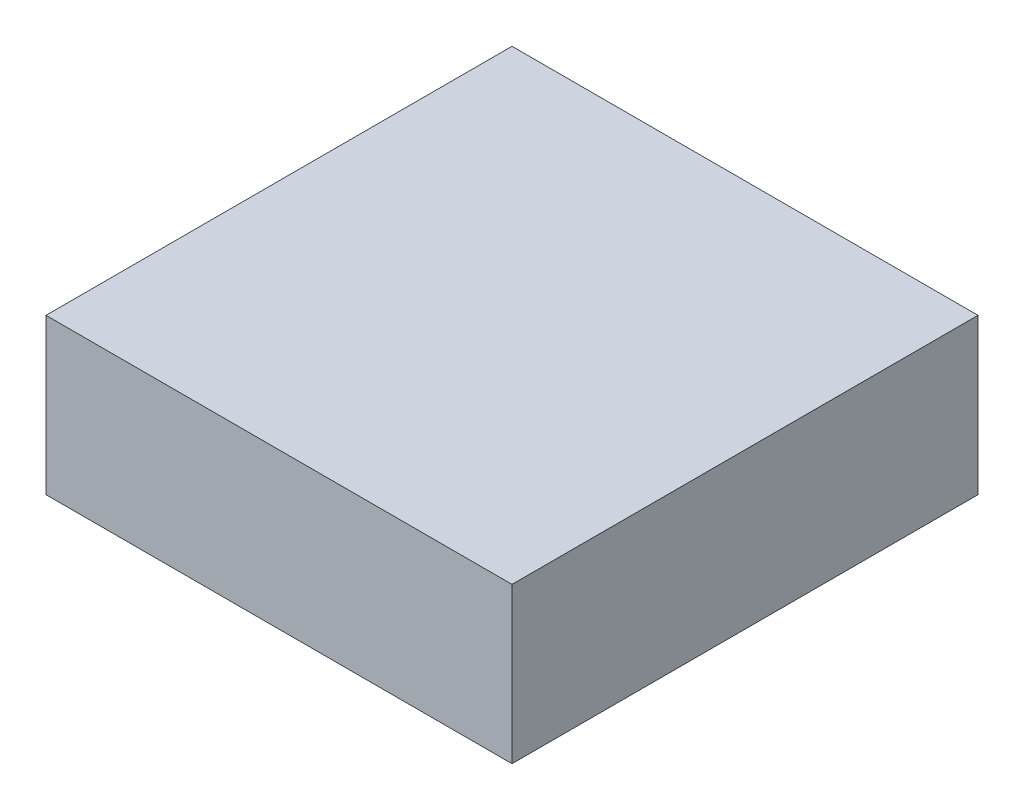
from build123d import *

# Parameters (mm, degrees)
SKETCH1_W           = 30
SKETCH1_H           = 30
SKETCH1_W_2         = 23
SKETCH1_H_2         = 7
BOSS_EXTRUDE1_DEPTH = 10
BOSS_EXTRUDE2_START = 7
SKETCH1_2_W         = 23
SKETCH1_2_H         = 7
BOSS_EXTRUDE2_DEPTH = 3


with BuildPart() as part:
    # Sketch1 → Boss-Extrude1 (new body)
    with BuildSketch(Plane(origin=(0, 0, 0), x_dir=(1, 0, 0), z_dir=(0, 1, 0))):
        Rectangle(SKETCH1_W, SKETCH1_H)
        Rectangle(SKETCH1_W_2, SKETCH1_H_2, mode=Mode.SUBTRACT)
    extrude(amount=BOSS_EXTRUDE1_DEPTH)

    # Sketch1<2> → Boss-Extrude2 (add)
    with BuildSketch(Plane(origin=(0, 0, 0), x_dir=(1, 0, 0), z_dir=(0, 1, 0)).offset(BOSS_EXTRUDE2_START)):
        Rectangle(SKETCH1_2_W, SKETCH1_2_H)
    extrude(amount=BOSS_EXTRUDE2_DEPTH)


solid = part.part
